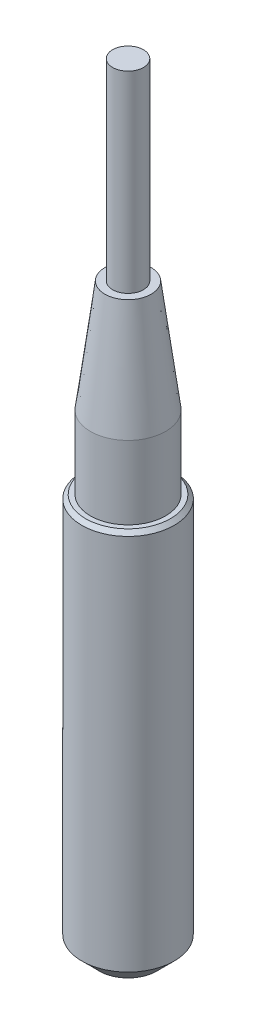
from build123d import *

# Parameters (mm, degrees)
CHAFL_N2_SIZE = 1


with BuildPart() as part:
    # Croquis1 → Revolución1 (revolve)
    with BuildSketch(Plane.XY, mode=Mode.PRIVATE) as revoluci_n1_sk:
        Polygon((12, -11.11234319), (12, 87.88765681), (9.75, 87.88765681), (0, 87.88765681), (0, -15.61234319), (7.5, -15.61234319), align=None)
    revolve(revoluci_n1_sk.sketch.rotate(Axis((0, 0, 0), (0, 1, 0)), 90), axis=Axis((0, 0, 0), (0, 1, 0)))

    # Chaflán2
    chafl_n2_edges = [part.edges().sort_by_distance(p)[0] for p in [
        (0, 87.88765681, 12),
    ]]
    chamfer(chafl_n2_edges, length=CHAFL_N2_SIZE)

    # Croquis2 → Revolución2 (revolve)
    with BuildSketch(Plane.XY, mode=Mode.PRIVATE) as revoluci_n2_sk:
        Polygon((0, 87.88765681), (9.75, 87.88765681), (9.75, 106.88765681), (6, 135.88765681), (4, 135.88765681), (4, 185.88765681), (0, 185.88765681), (0, 135.88765681), align=None)
    revolve(revoluci_n2_sk.sketch.rotate(Axis((0, 135.88765681, 0), (0, -1, 0)), 90), axis=Axis((0, 135.88765681, 0), (0, -1, 0)))


solid = part.part
